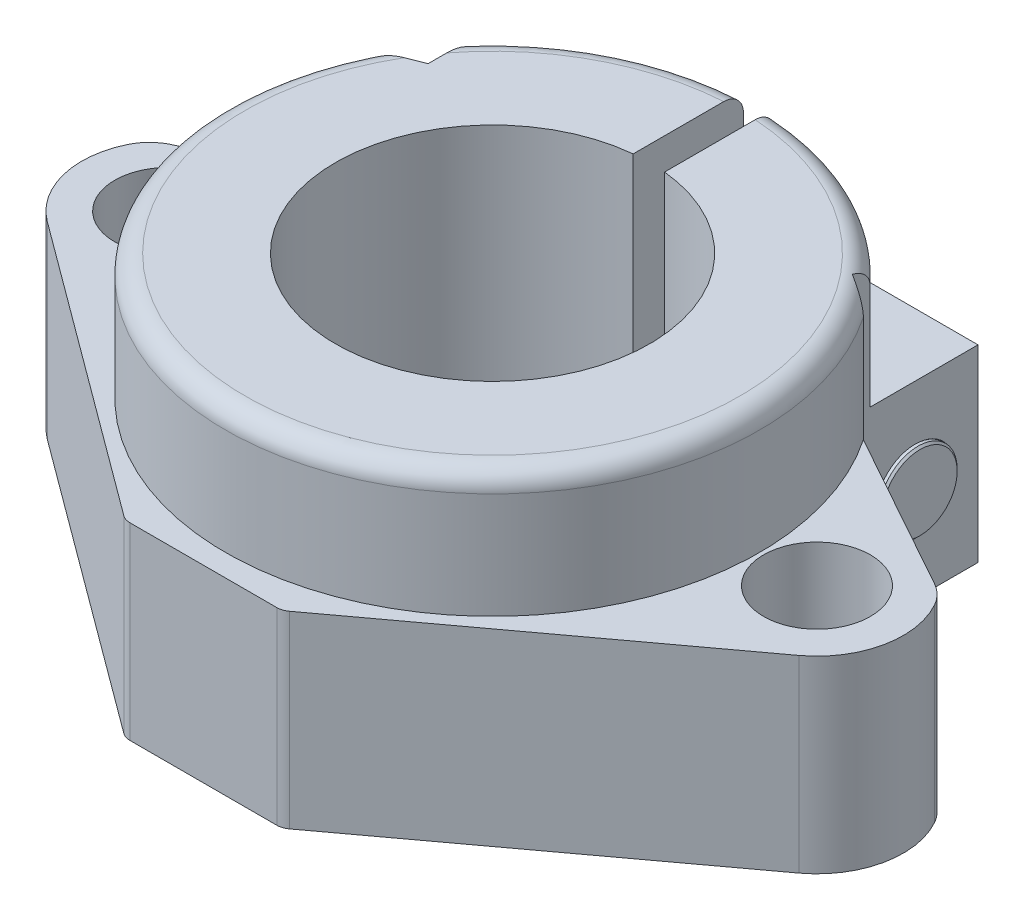
from build123d import *

# Parameters (mm, degrees)
SKETCH1_R                   = 3.4
BOSS_EXTRUDE1_DEPTH         = 12
SKETCH3_R                   = 17
BOSS_EXTRUDE2_DEPTH         = 8
FILLET1_R                   = 1.25
CUT_EXTRUDE1_DEPTH          = 35.152342526
CUT_EXTRUDE1_DEPTH_BACK     = 35.152342526
CUT_EXTRUDE2_DEPTH          = 38.714486708
CUT_EXTRUDE2_DEPTH_BACK     = 38.714486708
SKETCH4_R                   = 10
CUT_EXTRUDE3_DEPTH          = 38.714486708
CUT_EXTRUDE3_DEPTH_BACK     = 38.714486708
SKETCH5_W                   = 2
SKETCH5_H                   = 20
SKETCH7_R                   = 3
CUT_EXTRUDE4_DEPTH          = 12.5
FILLET2_R                   = 3
FILLET3_R                   = 1
M5_TAPPED_HOLE2_D           = 4.2
M5_TAPPED_HOLE2_CSINK_D     = 5.05
M5_TAPPED_HOLE2_CSINK_ANGLE = 90
BOSS_EXTRUDE4_DEPTH         = 0.001
BOSS_EXTRUDE4_DEPTH_BACK    = 25.5
SKETCH26_R                  = 2.5
SKETCH28_R                  = 4
BOSS_EXTRUDE5_DEPTH         = 5
CHAMFER1_SIZE               = 0.125
CUT_EXTRUDE5_DEPTH          = 3
FILLET4_R                   = 0.75


with BuildPart() as part:
    # Sketch1 → Boss-Extrude1 (new body)
    with BuildSketch(Plane(origin=(0, 0, 0), x_dir=(1, 0, 0), z_dir=(0, 1, 0))):
        with BuildLine():
            Line((5, -18.4), (-5, -18.4))
            Line((-5, -18.4), (-23.918139268, -4.42371628))
            ThreePointArc((-23.918139268, -4.42371628), (-26.110207266, -0.660406396), (-24.87856044, 3.516998238))
            Line((-24.87856044, 3.516998238), (-12.5, 18.4))
            Line((-12.5, 18.4), (12.5, 18.4))
            Line((12.5, 18.4), (24.87856044, 3.516998238))
            ThreePointArc((24.87856044, 3.516998238), (26.110207266, -0.660406396), (23.918139268, -4.42371628))
            Line((23.918139268, -4.42371628), (5, -18.4))
        make_face()
        with Locations(Location((-20.65, 0, 0), (0, 0, 270))):
            Circle(SKETCH1_R, mode=Mode.SUBTRACT)
        with Locations(Location((20.65, 0, 0), (0, 0, 90))):
            Circle(SKETCH1_R, mode=Mode.SUBTRACT)
    extrude(amount=BOSS_EXTRUDE1_DEPTH)

    # Sketch3 → Boss-Extrude2 (add)
    with BuildSketch(Plane(origin=(0, 12, 0), x_dir=(1, 0, 0), z_dir=(0, 1, 0))):
        with Locations(Location((0, 0, 0), (0, 0, 270))):
            Circle(SKETCH3_R)
    extrude(amount=BOSS_EXTRUDE2_DEPTH)

    # Fillet1
    fillet1_edges = [part.edges().sort_by_distance(p)[0] for p in [
        (0, 20, -17),
    ]]
    fillet(fillet1_edges, radius=FILLET1_R)

    # Sketch2 → Cut-Extrude1 (cut, two sides: drawn at the far end of the back side and taken through both)
    with BuildSketch(Plane(origin=(0, 12, 0), x_dir=(1, 0, 0), z_dir=(0, 1, 0)).offset(-CUT_EXTRUDE1_DEPTH_BACK)):
        Polygon((12.5, 18.4), (12.5, 10.4), (24.87856044, 3.516998238), align=None)
        Polygon((-12.5, 18.4), (-12.5, 8.399645995), (-24.87856044, 3.516998238), align=None)
    extrude(amount=CUT_EXTRUDE1_DEPTH + CUT_EXTRUDE1_DEPTH_BACK, mode=Mode.SUBTRACT)

    # Sketch4 → Cut-Extrude2 (cut, two sides: drawn at the far end of the back side and taken through both)
    with BuildSketch(Plane(origin=(0, 20, 0), x_dir=(1, 0, 0), z_dir=(0, 1, 0)).offset(-CUT_EXTRUDE2_DEPTH_BACK)):
        with Locations(Location((0, 0, 0), (0, 0, 270))):
            Circle(SKETCH4_R)
    extrude(amount=CUT_EXTRUDE2_DEPTH + CUT_EXTRUDE2_DEPTH_BACK, mode=Mode.SUBTRACT)

    # Sketch5 → Cut-Extrude3 (cut, two sides: drawn at the far end of the back side and taken through both)
    with BuildSketch(Plane(origin=(0, 20, 0), x_dir=(1, 0, 0), z_dir=(0, 1, 0)).offset(-CUT_EXTRUDE3_DEPTH_BACK)):
        with Locations((0, 10)):
            Rectangle(SKETCH5_W, SKETCH5_H)
    extrude(amount=CUT_EXTRUDE3_DEPTH + CUT_EXTRUDE3_DEPTH_BACK, mode=Mode.SUBTRACT)

    # Sketch7 → Cut-Extrude4 (cut)
    with BuildSketch(Plane.ZY.offset(12.5)):
        with Locations((-14.4, 6)):
            Circle(SKETCH7_R)
    extrude(amount=-CUT_EXTRUDE4_DEPTH, mode=Mode.SUBTRACT)

    # Fillet2
    fillet2_edges = [part.edges().sort_by_distance(p)[0] for p in [
        (24.87856044, 6, -3.516998238),
        (-24.87856044, 6, -3.516998238),
    ]]
    fillet(fillet2_edges, radius=FILLET2_R)

    # Fillet3
    fillet3_edges = [part.edges().sort_by_distance(p)[0] for p in [
        (5, 6, 18.4),
        (-5, 6, 18.4),
    ]]
    fillet(fillet3_edges, radius=FILLET3_R)

    # M5 Tapped Hole2 (through all)
    with Locations(Plane(origin=(12.5, 0, 0), x_dir=(0, 0, -1), z_dir=(1, 0, 0))):
        with Locations((14.4, 6)):
            CounterSinkHole(M5_TAPPED_HOLE2_D / 2, M5_TAPPED_HOLE2_CSINK_D / 2, counter_sink_angle=M5_TAPPED_HOLE2_CSINK_ANGLE)



with BuildPart() as body_2:
    # Sketch26 → Boss-Extrude4 (new, two sides: drawn at the far end of the back side and taken through both)
    with BuildSketch(Plane.ZY.offset(12.7).offset(-BOSS_EXTRUDE4_DEPTH_BACK)):
        with Locations((-14.4, 6)):
            Circle(SKETCH26_R)
    extrude(amount=BOSS_EXTRUDE4_DEPTH + BOSS_EXTRUDE4_DEPTH_BACK)


with BuildPart() as part_1:
    add(part.part)

    add(body_2.part)  # Boss-Extrude5 merges body 2
    # Sketch28 → Boss-Extrude5 (add)
    with BuildSketch(Plane.ZY.offset(12.701)):
        with Locations((-14.4, 6)):
            Circle(SKETCH28_R)
    extrude(amount=BOSS_EXTRUDE5_DEPTH)

    # Chamfer1
    chamfer1_edges = [part_1.edges().sort_by_distance(p)[0] for p in [
        (12.8, 6, -16.9),
    ]]
    chamfer(chamfer1_edges, length=CHAMFER1_SIZE)

    # Sketch29 → Cut-Extrude5 (cut)
    with BuildSketch(Plane.ZY.offset(17.701)):
        Polygon((-15.067828808, 8.570474279), (-16.960010429, 6.706880427), (-16.292181621, 4.136406148), (-13.732171192, 3.429525721), (-11.839989571, 5.293119573), (-12.507818379, 7.863593852), align=None)
    extrude(amount=-CUT_EXTRUDE5_DEPTH, mode=Mode.SUBTRACT)

    # Fillet4
    fillet4_edges = [part_1.edges().sort_by_distance(p)[0] for p in [
        (-17.701, 6, -18.4),
    ]]
    fillet(fillet4_edges, radius=FILLET4_R)


solid = part_1.part
